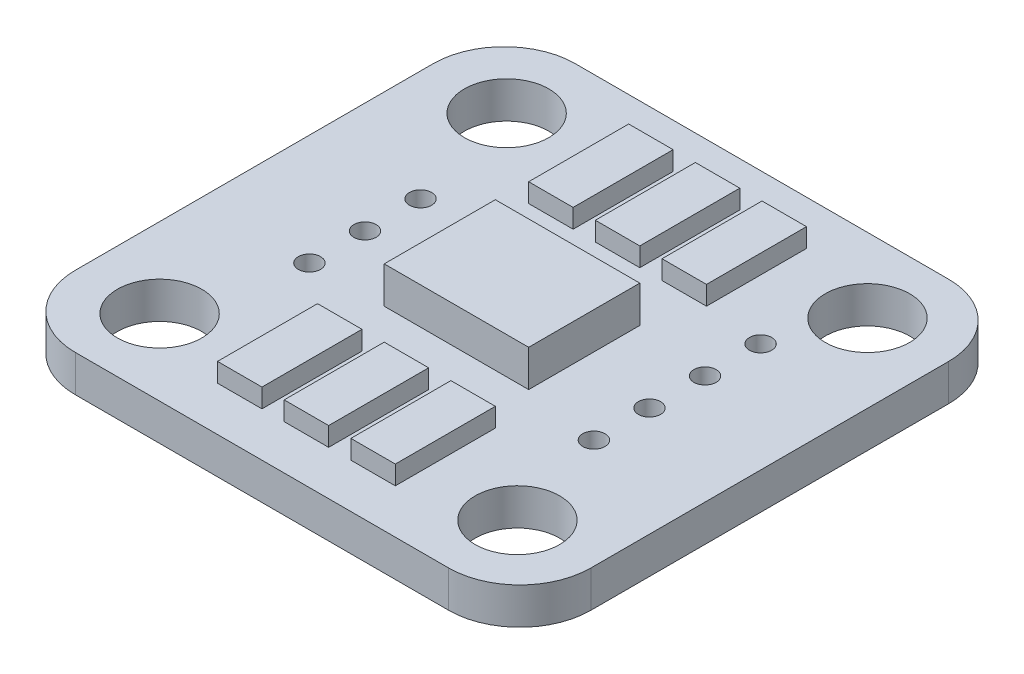
from build123d import *

# Parameters (mm, degrees)
SKETCH1_R           = 1.9
BOSS_EXTRUDE1_DEPTH = 1.65
SKETCH3_W           = 2
SKETCH3_H           = 4.5
BOSS_EXTRUDE2_DEPTH = 0.85
SKETCH4_W           = 6.5
SKETCH4_H           = 5
BOSS_EXTRUDE3_DEPTH = 1.65
SKETCH5_R           = 0.5
CUT_EXTRUDE1_DEPTH  = 17.243306314


with BuildPart() as part:
    # Sketch1 → Boss-Extrude1 (new body)
    with BuildSketch(Plane(origin=(0, 0, 0), x_dir=(1, 0, 0), z_dir=(0, 1, 0))):
        with BuildLine():
            Line((-8.4, -11.25), (8.4, -11.25))
            ThreePointArc((8.4, -11.25), (10.6627417, -10.3127417), (11.6, -8.05))
            Line((11.6, -8.05), (11.6, 8.05))
            ThreePointArc((11.6, 8.05), (10.6627417, 10.3127417), (8.4, 11.25))
            Line((8.4, 11.25), (-8.4, 11.25))
            ThreePointArc((-8.4, 11.25), (-10.6627417, 10.3127417), (-11.6, 8.05))
            Line((-11.6, 8.05), (-11.6, -8.05))
            ThreePointArc((-11.6, -8.05), (-10.6627417, -10.3127417), (-8.4, -11.25))
        make_face()
        with Locations(Location((-8.015151515, 7.773315047, 0), (0, 0, 270))):
            Circle(SKETCH1_R, mode=Mode.SUBTRACT)
        with Locations(Location((8.084848485, 7.909090909, 0), (0, 0, 270))):
            Circle(SKETCH1_R, mode=Mode.SUBTRACT)
        with Locations(Location((8.084848485, -7.840909091, 0), (0, 0, 270))):
            Circle(SKETCH1_R, mode=Mode.SUBTRACT)
        with Locations(Location((-8.015151515, -7.840909091, 0), (0, 0, 270))):
            Circle(SKETCH1_R, mode=Mode.SUBTRACT)
    extrude(amount=BOSS_EXTRUDE1_DEPTH)

    # Sketch3 → Boss-Extrude2 (add)
    with BuildSketch(Plane(origin=(0, 1.65, 0), x_dir=(1, 0, 0), z_dir=(0, 1, 0))):
        with Locations((-3, 7)):
            Rectangle(SKETCH3_W, SKETCH3_H)
        with Locations((0, 7)):
            Rectangle(SKETCH3_W, SKETCH3_H)
        with Locations((3, 7)):
            Rectangle(SKETCH3_W, SKETCH3_H)
        with Locations((3, -7)):
            Rectangle(SKETCH3_W, SKETCH3_H)
        with Locations((0, -7)):
            Rectangle(SKETCH3_W, SKETCH3_H)
        with Locations((-3, -7)):
            Rectangle(SKETCH3_W, SKETCH3_H)
    extrude(amount=BOSS_EXTRUDE2_DEPTH)

    # Sketch4 → Boss-Extrude3 (add)
    with BuildSketch(Plane(origin=(0, 1.65, 0), x_dir=(1, 0, 0), z_dir=(0, 1, 0))):
        Rectangle(SKETCH4_W, SKETCH4_H)
    extrude(amount=BOSS_EXTRUDE3_DEPTH)

    # Sketch5 → Cut-Extrude1 (cut, through all)
    with BuildSketch(Plane(origin=(0, 1.65, 0), x_dir=(1, 0, 0), z_dir=(0, 1, 0))):
        with Locations(Location((-6.615151515, 0, 0), (0, 0, 270))):
            Circle(SKETCH5_R)
        with Locations(Location((-6.615151515, 2.5, 0), (0, 0, 270))):
            Circle(SKETCH5_R)
        with Locations(Location((-6.615151515, -2.5, 0), (0, 0, 270))):
            Circle(SKETCH5_R)
        with Locations(Location((6.684848485, 4.5, 0), (0, 0, 270))):
            Circle(SKETCH5_R)
        with Locations(Location((6.684848485, 2, 0), (0, 0, 270))):
            Circle(SKETCH5_R)
        with Locations(Location((6.684848485, -0.5, 0), (0, 0, 270))):
            Circle(SKETCH5_R)
        with Locations(Location((6.684848485, -3, 0), (0, 0, 270))):
            Circle(SKETCH5_R)
    extrude(amount=-CUT_EXTRUDE1_DEPTH, mode=Mode.SUBTRACT)


solid = part.part
